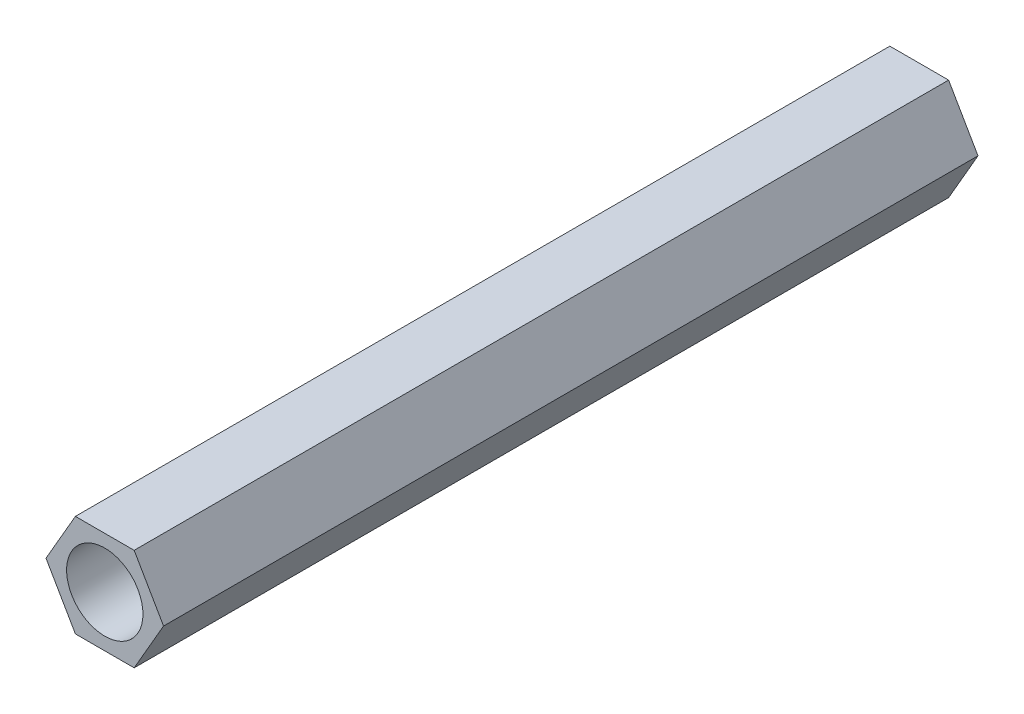
from build123d import *

# Parameters (mm, degrees)
SKETCH_1_R      = 1.5
EXTRUDE_1_DEPTH = 32


with BuildPart() as part:
    # 草图1 → 凸台-拉伸1 (new body)
    with BuildSketch(Plane.XY):
        Polygon((2.309401077, 0), (1.154700538, 2), (-1.154700538, 2), (-2.309401077, 0), (-1.154700538, -2), (1.154700538, -2), align=None)
        Circle(SKETCH_1_R, mode=Mode.SUBTRACT)
    extrude(amount=EXTRUDE_1_DEPTH)


solid = part.part
